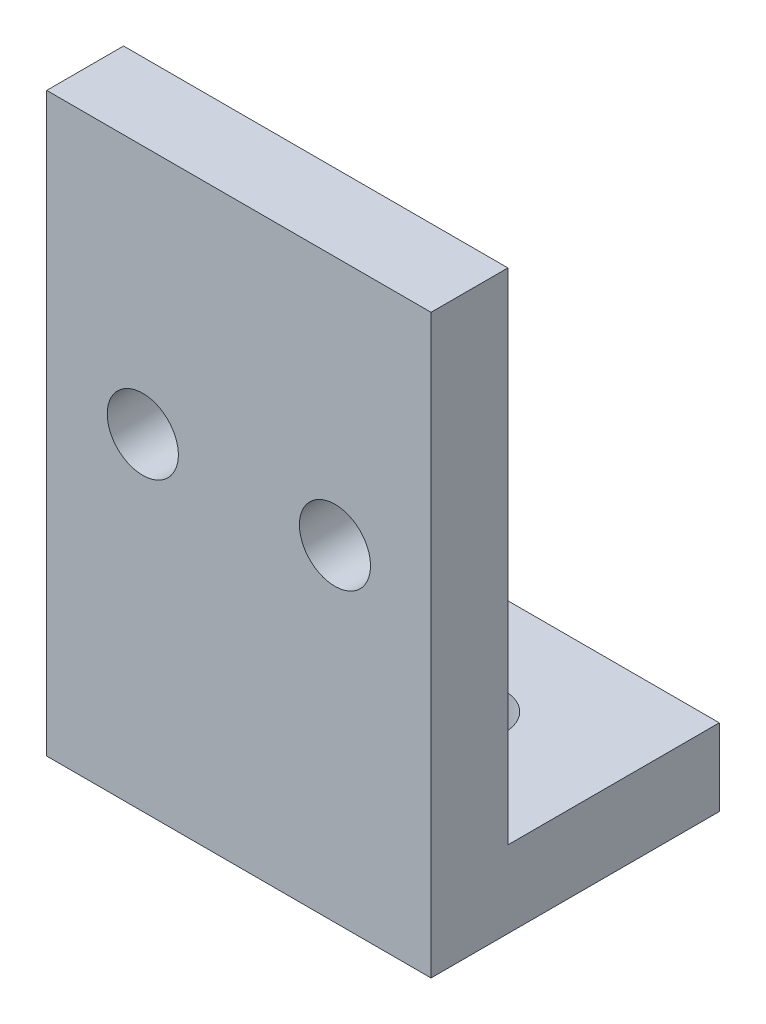
from build123d import *

# Parameters (mm, degrees)
BOSS_EXTRUDE1_DEPTH = 10
SKETCH2_R           = 1.85
CUT_EXTRUDE1_DEPTH  = 30.949958264
BOSS_EXTRUDE2_DEPTH = 10
SKETCH4_R           = 1.85
CUT_EXTRUDE2_DEPTH  = 30.949958264
CHAMFER1_SIZE       = 1


with BuildPart() as part:
    # Sketch1 → Boss-Extrude1 (new body)
    with BuildSketch(Plane(origin=(0, 0, 0), x_dir=(0, 0, -1), z_dir=(1, 0, 0))):
        Polygon((-4, 26), (0, 26), (0, 0), (11, 0), (11, -4), (-4, -4), align=None)
    extrude(amount=BOSS_EXTRUDE1_DEPTH)

    # Sketch2 → Cut-Extrude1 (cut, through all)
    with BuildSketch(Plane(origin=(0, 0, 0), x_dir=(1, 0, 0), z_dir=(0, 1, 0))):
        with Locations(Location((3, 5, 0), (0, 0, 270))):
            Circle(SKETCH2_R)
    extrude(amount=-CUT_EXTRUDE1_DEPTH, mode=Mode.SUBTRACT)

    # Sketch5 → Boss-Extrude2 (add)
    with BuildSketch(Plane.ZY):
        Polygon((-11, -4), (4, -4), (4, 26), (0, 26), (0, 0), (-11, 0), align=None)
    extrude(amount=BOSS_EXTRUDE2_DEPTH)

    # Sketch4 → Cut-Extrude2 (cut, through all)
    with BuildSketch(Plane(origin=(0, 0, 0), x_dir=(-1, 0, 0), z_dir=(0, 0, -1))):
        with Locations((-5, 13)):
            Circle(SKETCH4_R)
        with Locations((5, 13)):
            Circle(SKETCH4_R)
    extrude(amount=-CUT_EXTRUDE2_DEPTH, mode=Mode.SUBTRACT)

    # Chamfer1
    chamfer1_edges = [part.edges().sort_by_distance(p)[0] for p in [
        (6.85, 13, 0),
        (-3.15, 13, 0),
    ]]
    chamfer(chamfer1_edges, length=CHAMFER1_SIZE)


solid = part.part
